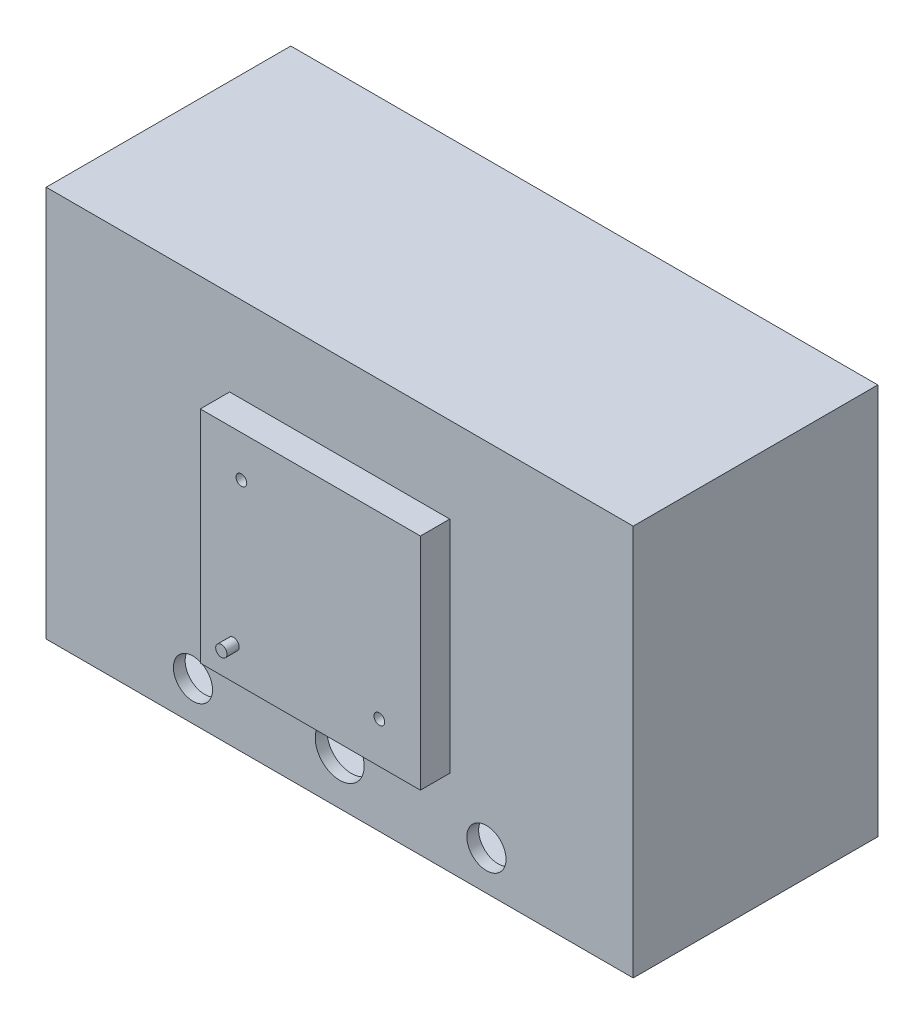
from build123d import *

# Parameters (mm, degrees)
SKETCH1_W           = 120
SKETCH1_H           = 80
SKETCH1_W_2         = 115.2
SKETCH1_H_2         = 75.2
BOSS_EXTRUDE1_DEPTH = 47.6
SKETCH2_W           = 120
SKETCH2_H           = 80
BOSS_EXTRUDE2_DEPTH = 2.4
SKETCH3_W           = 45
SKETCH3_H           = 45
BOSS_EXTRUDE3_DEPTH = 6
SKETCH4_R           = 1.1
CUT_EXTRUDE1_DEPTH  = 92.301697684
SKETCH5_R           = 1.15
BOSS_EXTRUDE4_DEPTH = 2.5
SKETCH6_R           = 4
SKETCH6_R_2         = 5
CUT_EXTRUDE2_DEPTH  = 3


with BuildPart() as part:
    # Sketch1 → Boss-Extrude1 (new body)
    with BuildSketch(Plane.XY):
        Rectangle(SKETCH1_W, SKETCH1_H)
        Rectangle(SKETCH1_W_2, SKETCH1_H_2, mode=Mode.SUBTRACT)
    extrude(amount=BOSS_EXTRUDE1_DEPTH)

    # Sketch2 → Boss-Extrude2 (add)
    with BuildSketch(Plane.XY.offset(47.6)):
        Rectangle(SKETCH2_W, SKETCH2_H)
    extrude(amount=BOSS_EXTRUDE2_DEPTH)

    # Sketch3 → Boss-Extrude3 (add)
    with BuildSketch(Plane.XY.offset(50)):
        Rectangle(SKETCH3_W, SKETCH3_H)
    extrude(amount=BOSS_EXTRUDE3_DEPTH)

    # Sketch4 → Cut-Extrude1 (cut, through all)
    with BuildSketch(Plane.XY.offset(56)):
        with Locations((-14.1, 14.1)):
            Circle(SKETCH4_R)
        with Locations((14.1, -14.1)):
            Circle(SKETCH4_R)
    extrude(amount=-CUT_EXTRUDE1_DEPTH, mode=Mode.SUBTRACT)

    # Sketch5 → Boss-Extrude4 (add)
    with BuildSketch(Plane.XY.offset(56)):
        with Locations((-15.7, -15.7)):
            Circle(SKETCH5_R)
    extrude(amount=BOSS_EXTRUDE4_DEPTH)

    # Sketch6 → Cut-Extrude2 (cut)
    with BuildSketch(Plane.XY.offset(50)):
        with Locations((-30, -32)):
            Circle(SKETCH6_R)
        with Locations((30, -32)):
            Circle(SKETCH6_R)
        with Locations((0, -30)):
            Circle(SKETCH6_R_2)
    extrude(amount=-CUT_EXTRUDE2_DEPTH, mode=Mode.SUBTRACT)


solid = part.part
